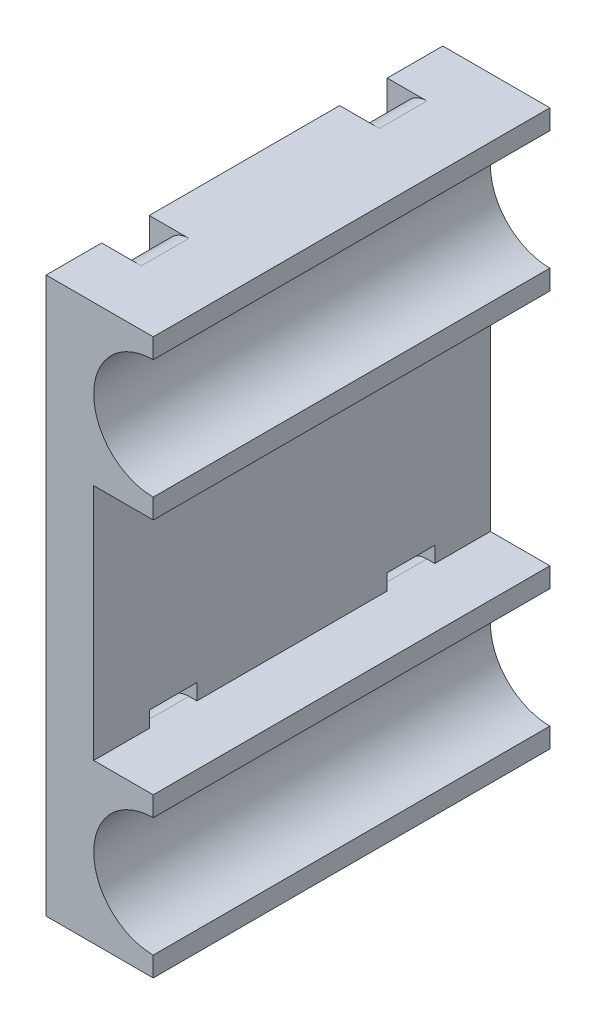
from build123d import *

# Parameters (mm, degrees)
RESSALTO_EXTRUS_O1_DEPTH = 50
ESBO_O2_W                = 6
ESBO_O2_H                = 2
CORTE_EXTRUS_O1_DEPTH    = 10
ESBO_O3_W                = 6
ESBO_O3_H                = 20
CORTE_EXTRUS_O2_DEPTH    = 2
FILETE1_R                = 3


with BuildPart() as part:
    # Esboço1 → Ressalto-extrusão1 (new body)
    with BuildSketch(Plane.XY):
        with BuildLine():
            Line((0, 35), (0, -35))
            Line((0, -35), (13.5, -35))
            Line((13.5, -35), (13.5, -32.5))
            ThreePointArc((13.5, -32.5), (6, -25), (13.5, -17.5))
            Line((13.5, -17.5), (13.5, -15))
            Line((13.5, -15), (6, -15))
            Line((6, -15), (6, 15))
            Line((6, 15), (13.5, 15))
            Line((13.5, 15), (13.5, 17.5))
            ThreePointArc((13.5, 17.5), (6, 25), (13.5, 32.5))
            Line((13.5, 32.5), (13.5, 35))
            Line((13.5, 35), (0, 35))
        make_face()
    extrude(amount=RESSALTO_EXTRUS_O1_DEPTH)

    # Esboço2 → Corte-extrusão1 (cut)
    with BuildSketch(Plane(origin=(6, 0, 0), x_dir=(0, 0, -1), z_dir=(1, 0, 0))):
        with Locations((-10, 14)):
            Rectangle(ESBO_O2_W, ESBO_O2_H)
        with Locations((-40, 14)):
            Rectangle(ESBO_O2_W, ESBO_O2_H)
        with Locations((-40, -14)):
            Rectangle(ESBO_O2_W, ESBO_O2_H)
        with Locations((-10, -14)):
            Rectangle(ESBO_O2_W, ESBO_O2_H)
    extrude(amount=-CORTE_EXTRUS_O1_DEPTH, mode=Mode.SUBTRACT)

    # Esboço3 → Corte-extrusão2 (cut)
    with BuildSketch(Plane.ZY):
        with Locations((10, 25)):
            Rectangle(ESBO_O3_W, ESBO_O3_H)
        with Locations((40, 25)):
            Rectangle(ESBO_O3_W, ESBO_O3_H)
        with Locations((40, -25)):
            Rectangle(ESBO_O3_W, ESBO_O3_H)
        with Locations((10, -25)):
            Rectangle(ESBO_O3_W, ESBO_O3_H)
    extrude(amount=-CORTE_EXTRUS_O2_DEPTH, mode=Mode.SUBTRACT)

    # Filete1
    filete1_edges = [part.edges().sort_by_distance(p)[0] for p in [
        (2, 15, 10),
        (2, 35, 10),
        (2, 15, 40),
        (2, 35, 40),
        (2, -15, 40),
        (2, -35, 40),
        (2, -15, 10),
        (2, -35, 10),
    ]]
    fillet(filete1_edges, radius=FILETE1_R)


solid = part.part
